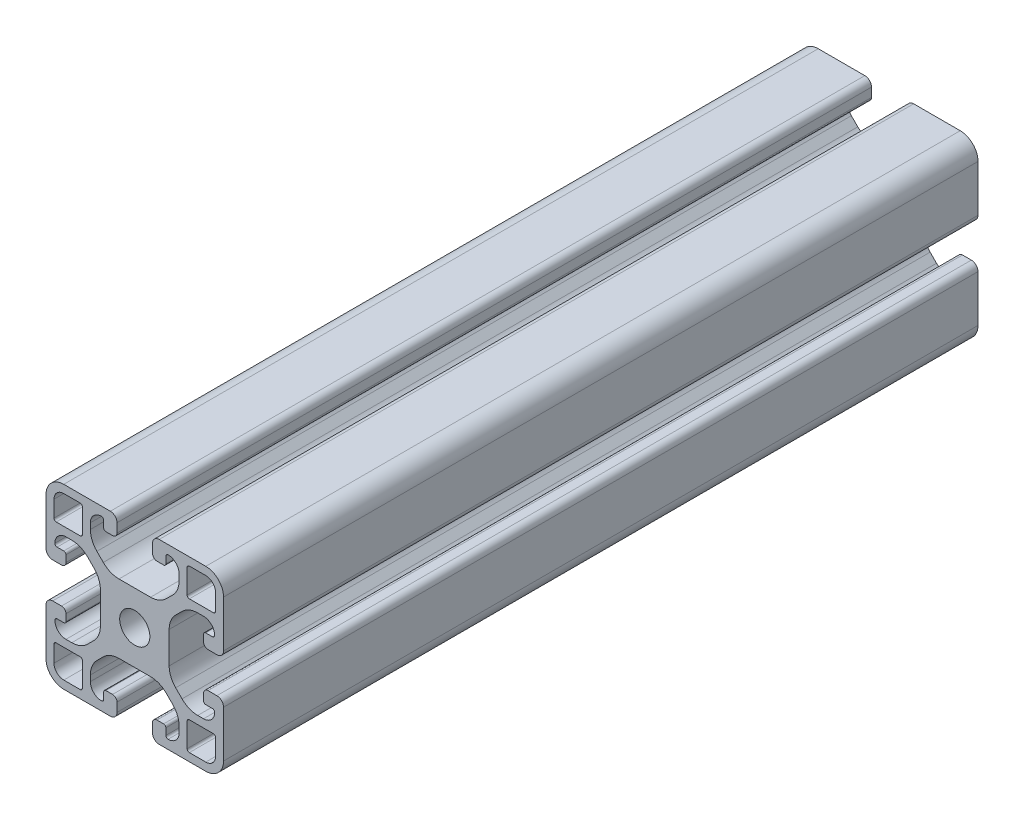
from build123d import *

# Parameters (mm, degrees)
ESQUISSE1_R        = 3.4
BOSS_EXTRU_1_DEPTH = 170


with BuildPart() as part:
    # Esquisse1 → Boss.-Extru.1 (new body)
    with BuildSketch(Plane(origin=(0, 0, -30), x_dir=(-1, 0, 0), z_dir=(0, 0, -1))):
        with BuildLine():
            Line((-4.5, 15), (-4.5, 13.5))
            ThreePointArc((-4.5, 13.5), (-4.353553391, 13.146446609), (-4, 13))
            Line((-4, 13), (-2.5, 13))
            ThreePointArc((-2.5, 13), (-2.146446609, 12.853553391), (-2, 12.5))
            ThreePointArc((-2, 12.5), (-2.732233047, 10.732233047), (-4.5, 10))
            Line((-4.5, 10), (-5.807611845, 10))
            ThreePointArc((-5.807611845, 10), (-7.721029006, 10.380602337), (-9.343145751, 11.464466094))
            Line((-9.343145751, 11.464466094), (-10.785533906, 12.906854249))
            ThreePointArc((-10.785533906, 12.906854249), (-11.869397663, 14.528970994), (-12.25, 16.442388155))
            Line((-12.25, 16.442388155), (-12.25, 23.557611845))
            ThreePointArc((-12.25, 23.557611845), (-11.869397663, 25.471029006), (-10.785533906, 27.093145751))
            Line((-10.785533906, 27.093145751), (-9.343145751, 28.535533906))
            ThreePointArc((-9.343145751, 28.535533906), (-7.721029006, 29.619397663), (-5.807611845, 30))
            Line((-5.807611845, 30), (-4.5, 30))
            ThreePointArc((-4.5, 30), (-2.732233047, 29.267766953), (-2, 27.5))
            ThreePointArc((-2, 27.5), (-2.146446609, 27.146446609), (-2.5, 27))
            Line((-2.5, 27), (-4, 27))
            ThreePointArc((-4, 27), (-4.353553391, 26.853553391), (-4.5, 26.5))
            Line((-4.5, 26.5), (-4.5, 25))
            ThreePointArc((-4.5, 25), (-4.207106781, 24.292893219), (-3.5, 24))
            Line((-3.5, 24), (-1.5, 24))
            ThreePointArc((-1.5, 24), (-0.439339828, 24.439339828), (0, 25.5))
            Line((0, 25.5), (0, 36))
            ThreePointArc((0, 36), (-1.171572875, 38.828427125), (-4, 40))
            Line((-4, 40), (-14.5, 40))
            ThreePointArc((-14.5, 40), (-15.560660172, 39.560660172), (-16, 38.5))
            Line((-16, 38.5), (-16, 36.5))
            ThreePointArc((-16, 36.5), (-15.707106781, 35.792893219), (-15, 35.5))
            Line((-15, 35.5), (-13.5, 35.5))
            ThreePointArc((-13.5, 35.5), (-13.146446609, 35.646446609), (-13, 36))
            Line((-13, 36), (-13, 37.5))
            ThreePointArc((-13, 37.5), (-12.853553391, 37.853553391), (-12.5, 38))
            ThreePointArc((-12.5, 38), (-10.732233047, 37.267766953), (-10, 35.5))
            Line((-10, 35.5), (-10, 34.192388155))
            ThreePointArc((-10, 34.192388155), (-10.380602337, 32.278970994), (-11.464466094, 30.656854249))
            Line((-11.464466094, 30.656854249), (-12.906854249, 29.214466094))
            ThreePointArc((-12.906854249, 29.214466094), (-14.528970994, 28.130602337), (-16.442388155, 27.75))
            Line((-16.442388155, 27.75), (-23.557611845, 27.75))
            ThreePointArc((-23.557611845, 27.75), (-25.471029006, 28.130602337), (-27.093145751, 29.214466094))
            Line((-27.093145751, 29.214466094), (-28.535533906, 30.656854249))
            ThreePointArc((-28.535533906, 30.656854249), (-29.619397663, 32.278970994), (-30, 34.192388155))
            Line((-30, 34.192388155), (-30, 35.5))
            ThreePointArc((-30, 35.5), (-29.267766953, 37.267766953), (-27.5, 38))
            ThreePointArc((-27.5, 38), (-27.146446609, 37.853553391), (-27, 37.5))
            Line((-27, 37.5), (-27, 36))
            ThreePointArc((-27, 36), (-26.853553391, 35.646446609), (-26.5, 35.5))
            Line((-26.5, 35.5), (-25, 35.5))
            ThreePointArc((-25, 35.5), (-24.292893219, 35.792893219), (-24, 36.5))
            Line((-24, 36.5), (-24, 38.5))
            ThreePointArc((-24, 38.5), (-24.439339828, 39.560660172), (-25.5, 40))
            Line((-25.5, 40), (-36, 40))
            ThreePointArc((-36, 40), (-38.828427125, 38.828427125), (-40, 36))
            Line((-40, 36), (-40, 25.5))
            ThreePointArc((-40, 25.5), (-39.560660172, 24.439339828), (-38.5, 24))
            Line((-38.5, 24), (-36.5, 24))
            ThreePointArc((-36.5, 24), (-35.792893219, 24.292893219), (-35.5, 25))
            Line((-35.5, 25), (-35.5, 26.5))
            ThreePointArc((-35.5, 26.5), (-35.646446609, 26.853553391), (-36, 27))
            Line((-36, 27), (-37.5, 27))
            ThreePointArc((-37.5, 27), (-37.853553391, 27.146446609), (-38, 27.5))
            ThreePointArc((-38, 27.5), (-37.267766953, 29.267766953), (-35.5, 30))
            Line((-35.5, 30), (-34.192388155, 30))
            ThreePointArc((-34.192388155, 30), (-32.278970994, 29.619397663), (-30.656854249, 28.535533906))
            Line((-30.656854249, 28.535533906), (-29.214466094, 27.093145751))
            ThreePointArc((-29.214466094, 27.093145751), (-28.130602337, 25.471029006), (-27.75, 23.557611845))
            Line((-27.75, 23.557611845), (-27.75, 16.442388155))
            ThreePointArc((-27.75, 16.442388155), (-28.130602337, 14.528970994), (-29.214466094, 12.906854249))
            Line((-29.214466094, 12.906854249), (-30.656854249, 11.464466094))
            ThreePointArc((-30.656854249, 11.464466094), (-32.278970994, 10.380602337), (-34.192388155, 10))
            Line((-34.192388155, 10), (-35.5, 10))
            ThreePointArc((-35.5, 10), (-37.267766953, 10.732233047), (-38, 12.5))
            ThreePointArc((-38, 12.5), (-37.853553391, 12.853553391), (-37.5, 13))
            Line((-37.5, 13), (-36, 13))
            ThreePointArc((-36, 13), (-35.646446609, 13.146446609), (-35.5, 13.5))
            Line((-35.5, 13.5), (-35.5, 15))
            ThreePointArc((-35.5, 15), (-35.792893219, 15.707106781), (-36.5, 16))
            Line((-36.5, 16), (-38.5, 16))
            ThreePointArc((-38.5, 16), (-39.560660172, 15.560660172), (-40, 14.5))
            Line((-40, 14.5), (-40, 4))
            ThreePointArc((-40, 4), (-38.828427125, 1.171572875), (-36, 0))
            Line((-36, 0), (-25.5, 0))
            ThreePointArc((-25.5, 0), (-24.439339828, 0.439339828), (-24, 1.5))
            Line((-24, 1.5), (-24, 3.5))
            ThreePointArc((-24, 3.5), (-24.292893219, 4.207106781), (-25, 4.5))
            Line((-25, 4.5), (-26.5, 4.5))
            ThreePointArc((-26.5, 4.5), (-26.853553391, 4.353553391), (-27, 4))
            Line((-27, 4), (-27, 2.5))
            ThreePointArc((-27, 2.5), (-27.146446609, 2.146446609), (-27.5, 2))
            ThreePointArc((-27.5, 2), (-29.267766953, 2.732233047), (-30, 4.5))
            Line((-30, 4.5), (-30, 5.807611845))
            ThreePointArc((-30, 5.807611845), (-29.619397663, 7.721029006), (-28.535533906, 9.343145751))
            Line((-28.535533906, 9.343145751), (-27.093145751, 10.785533906))
            ThreePointArc((-27.093145751, 10.785533906), (-25.471029006, 11.869397663), (-23.557611845, 12.25))
            Line((-23.557611845, 12.25), (-16.442388155, 12.25))
            ThreePointArc((-16.442388155, 12.25), (-14.528970994, 11.869397663), (-12.906854249, 10.785533906))
            Line((-12.906854249, 10.785533906), (-11.464466094, 9.343145751))
            ThreePointArc((-11.464466094, 9.343145751), (-10.380602337, 7.721029006), (-10, 5.807611845))
            Line((-10, 5.807611845), (-10, 4.5))
            ThreePointArc((-10, 4.5), (-10.732233047, 2.732233047), (-12.5, 2))
            ThreePointArc((-12.5, 2), (-12.853553391, 2.146446609), (-13, 2.5))
            Line((-13, 2.5), (-13, 4))
            ThreePointArc((-13, 4), (-13.146446609, 4.353553391), (-13.5, 4.5))
            Line((-13.5, 4.5), (-15, 4.5))
            ThreePointArc((-15, 4.5), (-15.707106781, 4.207106781), (-16, 3.5))
            Line((-16, 3.5), (-16, 1.5))
            ThreePointArc((-16, 1.5), (-15.560660172, 0.439339828), (-14.5, 0))
            Line((-14.5, 0), (-4, 0))
            ThreePointArc((-4, 0), (-1.171572875, 1.171572875), (0, 4))
            Line((0, 4), (0, 14.5))
            ThreePointArc((0, 14.5), (-0.439339828, 15.560660172), (-1.5, 16))
            Line((-1.5, 16), (-3.5, 16))
            ThreePointArc((-3.5, 16), (-4.207106781, 15.707106781), (-4.5, 15))
        make_face()
        with Locations(Location((-20, 20, 0), (0, 0, 180))):
            Circle(ESQUISSE1_R, mode=Mode.SUBTRACT)
        with BuildLine():
            Line((-4, 1.8), (-7.7, 1.8))
            ThreePointArc((-7.7, 1.8), (-8.053553391, 1.946446609), (-8.2, 2.3))
            Line((-8.2, 2.3), (-8.2, 7.7))
            ThreePointArc((-8.2, 7.7), (-8.053553391, 8.053553391), (-7.7, 8.2))
            Line((-7.7, 8.2), (-2.3, 8.2))
            ThreePointArc((-2.3, 8.2), (-1.946446609, 8.053553391), (-1.8, 7.7))
            Line((-1.8, 7.7), (-1.8, 4))
            ThreePointArc((-1.8, 4), (-2.444365081, 2.444365081), (-4, 1.8))
        make_face(mode=Mode.SUBTRACT)
        with BuildLine():
            Line((-38.2, 4), (-38.2, 7.7))
            ThreePointArc((-38.2, 7.7), (-38.053553391, 8.053553391), (-37.7, 8.2))
            Line((-37.7, 8.2), (-32.3, 8.2))
            ThreePointArc((-32.3, 8.2), (-31.946446609, 8.053553391), (-31.8, 7.7))
            Line((-31.8, 7.7), (-31.8, 2.3))
            ThreePointArc((-31.8, 2.3), (-31.946446609, 1.946446609), (-32.3, 1.8))
            Line((-32.3, 1.8), (-36, 1.8))
            ThreePointArc((-36, 1.8), (-37.555634919, 2.444365081), (-38.2, 4))
        make_face(mode=Mode.SUBTRACT)
        with BuildLine():
            Line((-36, 38.2), (-32.3, 38.2))
            ThreePointArc((-32.3, 38.2), (-31.946446609, 38.053553391), (-31.8, 37.7))
            Line((-31.8, 37.7), (-31.8, 32.3))
            ThreePointArc((-31.8, 32.3), (-31.946446609, 31.946446609), (-32.3, 31.8))
            Line((-32.3, 31.8), (-37.7, 31.8))
            ThreePointArc((-37.7, 31.8), (-38.053553391, 31.946446609), (-38.2, 32.3))
            Line((-38.2, 32.3), (-38.2, 36))
            ThreePointArc((-38.2, 36), (-37.555634919, 37.555634919), (-36, 38.2))
        make_face(mode=Mode.SUBTRACT)
        with BuildLine():
            Line((-1.8, 36), (-1.8, 32.3))
            ThreePointArc((-1.8, 32.3), (-1.946446609, 31.946446609), (-2.3, 31.8))
            Line((-2.3, 31.8), (-7.7, 31.8))
            ThreePointArc((-7.7, 31.8), (-8.053553391, 31.946446609), (-8.2, 32.3))
            Line((-8.2, 32.3), (-8.2, 37.7))
            ThreePointArc((-8.2, 37.7), (-8.053553391, 38.053553391), (-7.7, 38.2))
            Line((-7.7, 38.2), (-4, 38.2))
            ThreePointArc((-4, 38.2), (-2.444365081, 37.555634919), (-1.8, 36))
        make_face(mode=Mode.SUBTRACT)
    extrude(amount=-BOSS_EXTRU_1_DEPTH)


solid = part.part
